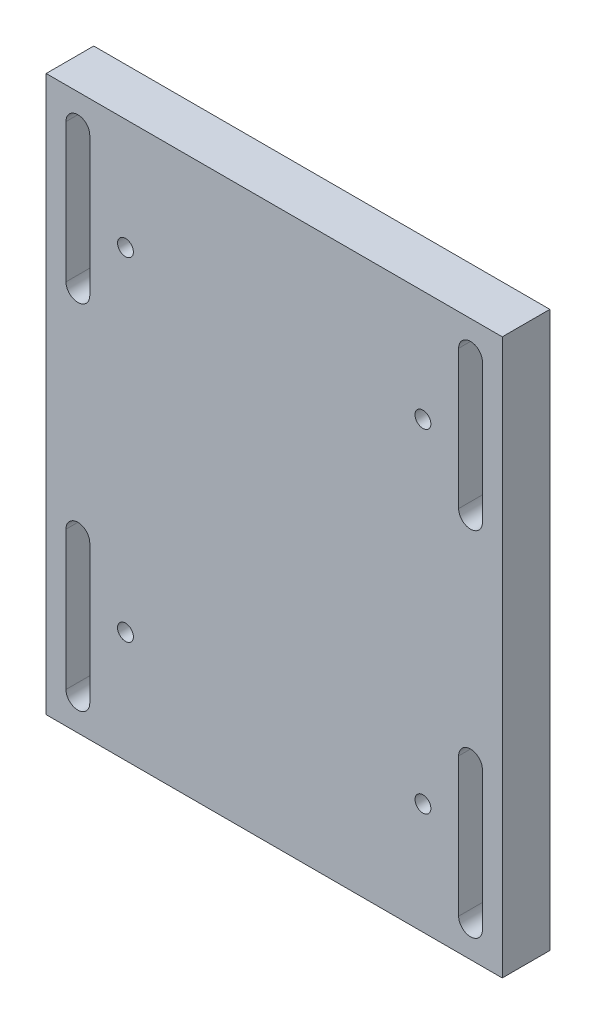
from build123d import *

# Parameters (mm, degrees)
SKETCH1_W               = 115
SKETCH1_H               = 140
BOSS_EXTRUDE1_DEPTH     = 6
CUT_EXTRUDE1_DEPTH      = 12
SKETCH5_R               = 2
CUT_EXTRUDE2_DEPTH      = 12
MIRROR2_COPY_1_DEPTH    = 12
MIRROR2_COPY_2_SKETCH_R = 2
MIRROR2_COPY_2_DEPTH    = 12


with BuildPart() as part:
    # Sketch1 → Boss-Extrude1 (new, symmetric)
    with BuildSketch(Plane.XY):
        Rectangle(SKETCH1_W, SKETCH1_H)
    extrude(amount=BOSS_EXTRUDE1_DEPTH, both=True)

    # Sketch4 → Cut-Extrude1 (cut)
    with BuildSketch(Plane.XY.offset(6)):
        with BuildLine():
            Line((52.5, 62), (52.5, 27))
            ThreePointArc((52.5, 27), (49.5, 24), (46.5, 27))
            Line((46.5, 27), (46.5, 62))
            ThreePointArc((46.5, 62), (49.5, 65), (52.5, 62))
        make_face()
    cut_extrude1 = extrude(amount=-CUT_EXTRUDE1_DEPTH, mode=Mode.SUBTRACT)

    # Sketch5 → Cut-Extrude2 (cut)
    with BuildSketch(Plane.XY.offset(6)):
        with Locations((37.5, 42)):
            Circle(SKETCH5_R)
    cut_extrude2 = extrude(amount=-CUT_EXTRUDE2_DEPTH, mode=Mode.SUBTRACT)

    # Mirror1: Cut-Extrude1, Cut-Extrude2 across plane
    add(cut_extrude1.mirror(Plane.ZX), mode=Mode.SUBTRACT)
    add(cut_extrude2.mirror(Plane.ZX), mode=Mode.SUBTRACT)

    # Mirror2: Cut-Extrude1, Cut-Extrude2 across plane
    add(cut_extrude1.mirror(Plane(origin=(0, 0, 0), x_dir=(0, 0, 1), z_dir=(1, 0, 0))), mode=Mode.SUBTRACT)
    add(cut_extrude2.mirror(Plane(origin=(0, 0, 0), x_dir=(0, 0, 1), z_dir=(1, 0, 0))), mode=Mode.SUBTRACT)

    # Mirror2 copy 1 sketch → Mirror2 copy 1 (cut)
    with BuildSketch(Plane(origin=(0, 0, 6), x_dir=(-1, 0, 0), z_dir=(0, 0, 1))):
        with BuildLine():
            Line((52.5, 62), (52.5, 27))
            ThreePointArc((52.5, 27), (49.5, 24), (46.5, 27))
            Line((46.5, 27), (46.5, 62))
            ThreePointArc((46.5, 62), (49.5, 65), (52.5, 62))
        make_face()
    extrude(amount=-MIRROR2_COPY_1_DEPTH, mode=Mode.SUBTRACT)

    # Mirror2 copy 2 sketch → Mirror2 copy 2 (cut)
    with BuildSketch(Plane(origin=(0, 0, 6), x_dir=(-1, 0, 0), z_dir=(0, 0, 1))):
        with Locations((37.5, 42)):
            Circle(MIRROR2_COPY_2_SKETCH_R)
    extrude(amount=-MIRROR2_COPY_2_DEPTH, mode=Mode.SUBTRACT)


solid = part.part
